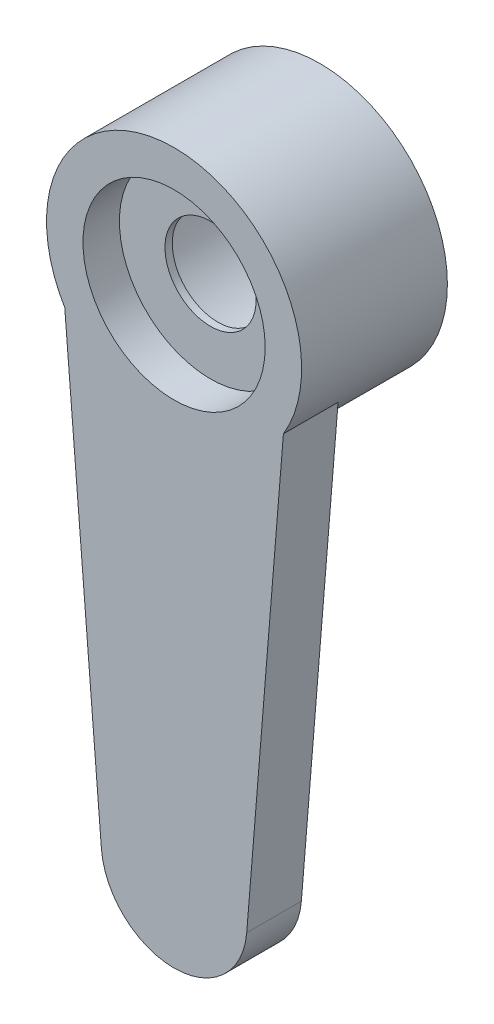
from build123d import *

# Parameters (mm, degrees)
SKETCH1_R           = 3.5
SKETCH1_R_2         = 2.5
BOSS_EXTRUDE1_DEPTH = 2.8
SKETCH2_R           = 3.5
SKETCH2_R_2         = 1.25
BOSS_EXTRUDE2_DEPTH = 0.2
SKETCH3_R           = 3.5
SKETCH3_R_2         = 2.5
BOSS_EXTRUDE3_DEPTH = 1
BOSS_EXTRUDE4_START = -1.5
BOSS_EXTRUDE4_DEPTH = 1.5


with BuildPart() as part:
    # Sketch1 → Boss-Extrude1 (new body)
    with BuildSketch(Plane.XY):
        Circle(SKETCH1_R)
        Circle(SKETCH1_R_2, mode=Mode.SUBTRACT)
    extrude(amount=BOSS_EXTRUDE1_DEPTH)

    # Sketch2 → Boss-Extrude2 (add)
    with BuildSketch(Plane.XY.offset(2.8)):
        Circle(SKETCH2_R)
        Circle(SKETCH2_R_2, mode=Mode.SUBTRACT)
    extrude(amount=BOSS_EXTRUDE2_DEPTH)

    # Sketch3 → Boss-Extrude3 (add)
    with BuildSketch(Plane.XY.offset(3)):
        Circle(SKETCH3_R)
        Circle(SKETCH3_R_2, mode=Mode.SUBTRACT)
    extrude(amount=BOSS_EXTRUDE3_DEPTH)

    # Sketch4 → Boss-Extrude4 (add)
    with BuildSketch(Plane.XY.offset(4).offset(BOSS_EXTRUDE4_START)):
        with BuildLine():
            Line((-3, -1.802775638), (-1.993399861, -14.162348377))
            ThreePointArc((-1.993399861, -14.162348377), (0, -16), (1.993399861, -14.162348377))
            Line((1.993399861, -14.162348377), (3, -1.802775638))
            ThreePointArc((3, -1.802775638), (0, -3.5), (-3, -1.802775638))
        make_face()
    extrude(amount=BOSS_EXTRUDE4_DEPTH)


solid = part.part
